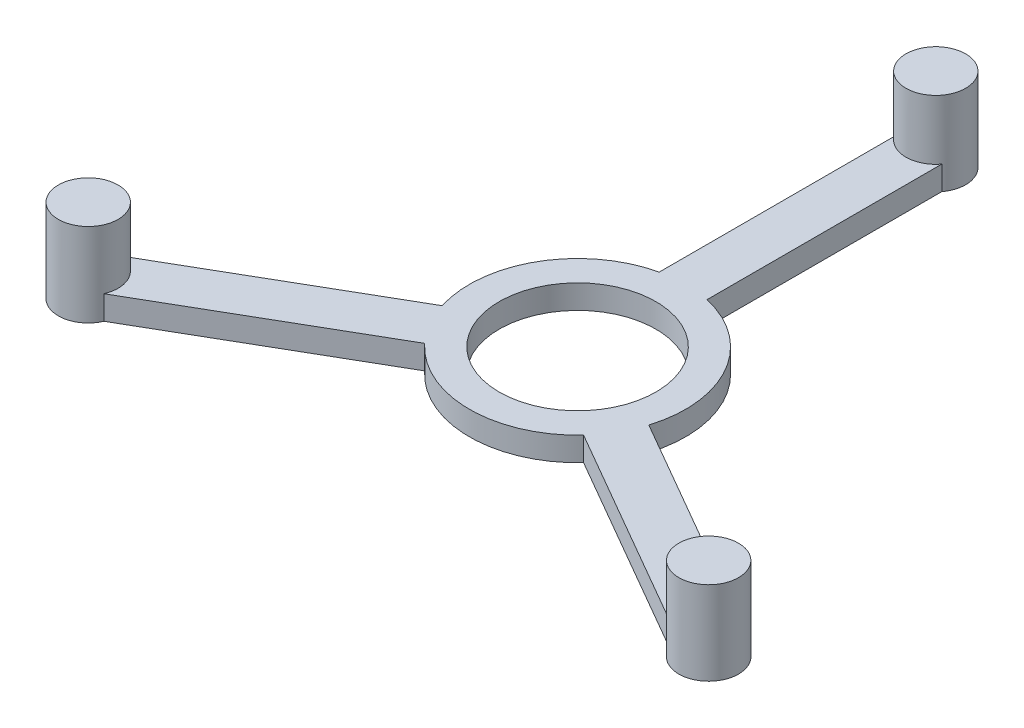
from build123d import *

# Parameters (mm, degrees)
SKETCH1_R           = 8.334375
BOSS_EXTRUDE1_DEPTH = 2.54
SKETCH3_R           = 3.175
BOSS_EXTRUDE2_DEPTH = 6.35
CIRPATTERN1_COUNT   = 3


with BuildPart() as part:
    # Sketch1 → Boss-Extrude1 (new body)
    with BuildSketch(Plane(origin=(0, 0, 0), x_dir=(1, 0, 0), z_dir=(0, 1, 0))):
        with BuildLine():
            Line((2.54, 11.225600781), (2.54, 36.195))
            ThreePointArc((2.54, 36.195), (0, 41.275), (-2.54, 36.195))
            Line((-2.54, 36.195), (-2.54, 11.225600781))
            ThreePointArc((-2.54, 11.225600781), (0, -11.509375), (2.54, 11.225600781))
        make_face()
        with Locations(Location((0, 0, 0), (0, 0, 270))):
            Circle(SKETCH1_R, mode=Mode.SUBTRACT)
    boss_extrude1 = extrude(amount=BOSS_EXTRUDE1_DEPTH)

    # Sketch3 → Boss-Extrude2 (add)
    with BuildSketch(Plane(origin=(0, 2.54, 0), x_dir=(1, 0, 0), z_dir=(0, 1, 0))):
        with Locations(Location((0, 38.1, 0), (0, 0, 216.869897646))):
            Circle(SKETCH3_R)
    boss_extrude2 = extrude(amount=BOSS_EXTRUDE2_DEPTH)

    # CirPattern1: Boss-Extrude1, Boss-Extrude2 ×3 about axis
    cirpattern1_axis = Axis((0, 0, 0), (0, 1, 0))
    add([boss_extrude1.rotate(cirpattern1_axis, i * 360 / CIRPATTERN1_COUNT) for i in range(1, CIRPATTERN1_COUNT)])
    add([boss_extrude2.rotate(cirpattern1_axis, i * 360 / CIRPATTERN1_COUNT) for i in range(1, CIRPATTERN1_COUNT)])


solid = part.part
